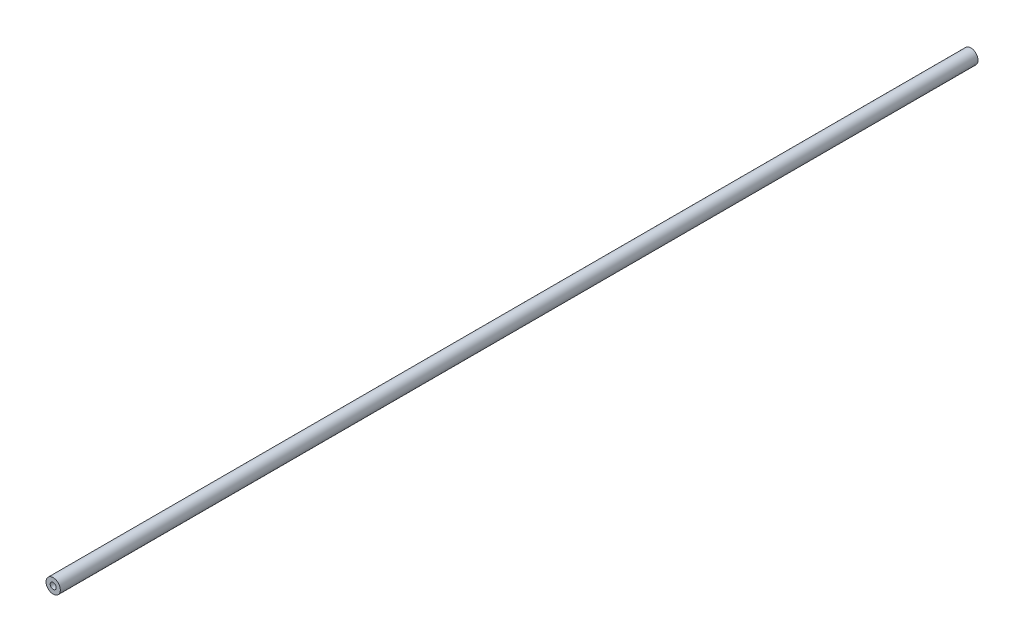
from build123d import *

# Parameters (mm, degrees)
SKETCH1_R                            = 4.7625
BOSS_EXTRUDE1_DEPTH                  = 304.8
F_10_32_TAPPED_HOLE1_D               = 4.0386
F_10_32_TAPPED_HOLE1_DEPTH           = 12.02944
F_10_32_TAPPED_HOLE1_TIP             = 1.213317848
F_10_32_TAPPED_HOLE1_ON_FACE_2_D     = 4.0386
F_10_32_TAPPED_HOLE1_ON_FACE_2_DEPTH = 12.02944
F_10_32_TAPPED_HOLE1_ON_FACE_2_TIP   = 1.213317848


with BuildPart() as part:
    # Sketch1 → Boss-Extrude1 (new, symmetric)
    with BuildSketch(Plane.XY):
        with Locations(Location((0, 0, 0), (0, 0, 180))):
            Circle(SKETCH1_R)
    extrude(amount=BOSS_EXTRUDE1_DEPTH, both=True)

    # #10-32 Tapped Hole1
    with Locations(Plane(origin=(0, 0, -304.8), x_dir=(-1, 0, 0), z_dir=(0, 0, -1))):
        with Locations((0, 0)):
            Hole(F_10_32_TAPPED_HOLE1_D / 2, depth=F_10_32_TAPPED_HOLE1_DEPTH)
            with Locations((0, 0, -(F_10_32_TAPPED_HOLE1_DEPTH + F_10_32_TAPPED_HOLE1_TIP / 2))):  # 118° drill point
                Cone(0, F_10_32_TAPPED_HOLE1_D / 2, F_10_32_TAPPED_HOLE1_TIP, mode=Mode.SUBTRACT)

    # #10-32 Tapped Hole1 on face 2
    with Locations(Plane.XY.offset(304.8)):
        with Locations((0, 0)):
            Hole(F_10_32_TAPPED_HOLE1_ON_FACE_2_D / 2, depth=F_10_32_TAPPED_HOLE1_ON_FACE_2_DEPTH)
            with Locations((0, 0, -(F_10_32_TAPPED_HOLE1_ON_FACE_2_DEPTH + F_10_32_TAPPED_HOLE1_ON_FACE_2_TIP / 2))):  # 118° drill point
                Cone(0, F_10_32_TAPPED_HOLE1_ON_FACE_2_D / 2, F_10_32_TAPPED_HOLE1_ON_FACE_2_TIP, mode=Mode.SUBTRACT)


solid = part.part
